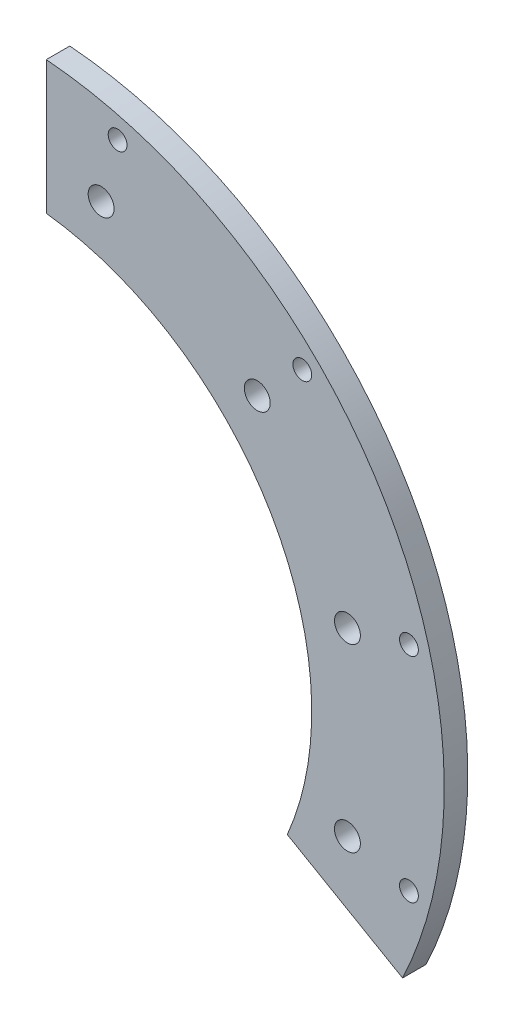
from build123d import *

# Parameters (mm, degrees)
BOSS_EXTRU_1_DEPTH = 4
SKETCH2_R          = 1.6
SKETCH2_R_2        = 2.2
CUT_EXTRUDE1_DEPTH = 105.004154725
CIRPATTERN1_COUNT  = 12


with BuildPart() as part:
    # Esquisse1 → Boss.-Extru.1 (new body)
    with BuildSketch(Plane.XY):
        with BuildLine():
            Line((6, 73.365060485), (6, 50.746526975))
            ThreePointArc((6, 50.746526975), (44.255153019, 25.547826351), (46.94579921, -20.181722835))
            Line((46.94579921, -20.181722835), (66.533866524, -31.490898771))
            ThreePointArc((66.533866524, -31.490898771), (63.749380359, 36.802834183), (6, 73.365060485))
        make_face()
    extrude(amount=BOSS_EXTRU_1_DEPTH)

    # Sketch2 → Cut-Extrude1 (cut, through all)
    with BuildSketch(Plane.XY.offset(4)):
        with Locations((18.117333157, 67.61480784)):
            Circle(SKETCH2_R)
        with Locations((15.316911089, 57.1634904)):
            Circle(SKETCH2_R_2)
    cut_extrude1 = extrude(amount=-CUT_EXTRUDE1_DEPTH, mode=Mode.SUBTRACT)

    # CirPattern1: Cut-Extrude1 ×12 about axis
    cirpattern1_axis = Axis((0, 0, -0.2), (0, 0, 1))
    for i in range(1, CIRPATTERN1_COUNT):
        add(cut_extrude1.rotate(cirpattern1_axis, i * 360 / CIRPATTERN1_COUNT), mode=Mode.SUBTRACT)


solid = part.part
